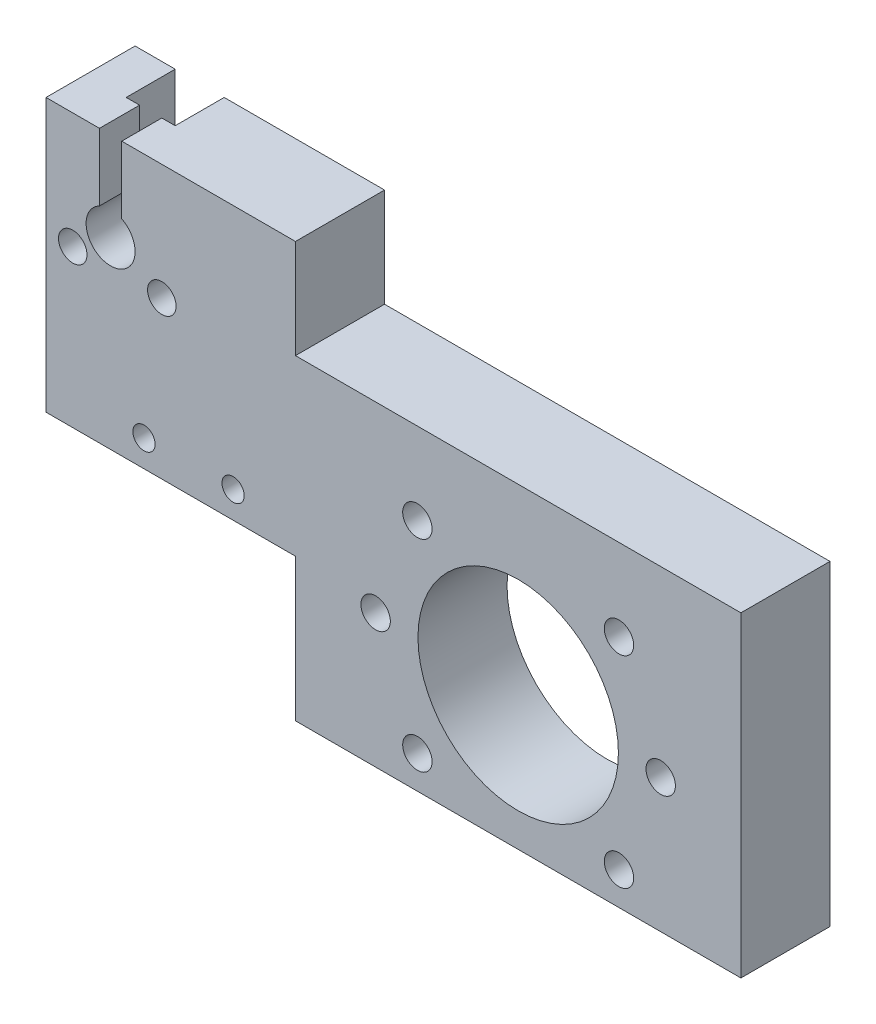
from build123d import *

# Parameters (mm, degrees)
SKETCH_1_W          = 50
SKETCH_1_H          = 35.5
EXTRUDE_1_DEPTH     = 10
SKETCH_2_R          = 11.25
CUT_EXTRUDE_1_DEPTH = 33.25
SKETCH_3_R          = 1.65
CUT_EXTRUDE_2_DEPTH = 33.25
SKETCH_4_W          = 25
SKETCH_4_H          = 19.5
EXTRUDE_2_DEPTH     = 10
SKETCH_5_R          = 1.25
CUT_EXTRUDE_3_DEPTH = 10
SKETCH_7_W          = 25
SKETCH_7_H          = 10
EXTRUDE_4_DEPTH     = 11.1
SKETCH_8_W          = 2.5
SKETCH_8_H          = 10
CUT_EXTRUDE_4_DEPTH = 59.586026491
SKETCH_9_W          = 5.5
SKETCH_9_H          = 10
CUT_EXTRUDE_5_DEPTH = 5.5
SKETCH_10_W         = 10
SKETCH_10_H         = 30.6
EXTRUDE_5_DEPTH     = 3
SKETCH_11_R         = 2.75
CUT_EXTRUDE_6_DEPTH = 62.166351044
SKETCH_13_R         = 1.6
CUT_EXTRUDE_8_DEPTH = 62.166351044


with BuildPart() as part:
    # 草图1 → 凸台-拉伸1 (new body)
    with BuildSketch(Plane.XY):
        Rectangle(SKETCH_1_W, SKETCH_1_H)
    extrude(amount=EXTRUDE_1_DEPTH)

    # 草图2 → 切除-拉伸1 (cut, through all)
    with BuildSketch(Plane.XY.offset(10)):
        with Locations((0, -2.75)):
            Circle(SKETCH_2_R)
    extrude(amount=-CUT_EXTRUDE_1_DEPTH, mode=Mode.SUBTRACT)

    # 草图3 → 切除-拉伸2 (cut, through all)
    with BuildSketch(Plane.XY.offset(10)):
        with Locations((-16, -2.75)):
            Circle(SKETCH_3_R)
        with Locations((-11.313708499, 8.563708499)):
            Circle(SKETCH_3_R)
        with Locations((11.313708499, 8.563708499)):
            Circle(SKETCH_3_R)
        with Locations((16, -2.75)):
            Circle(SKETCH_3_R)
        with Locations((11.313708499, -14.063708499)):
            Circle(SKETCH_3_R)
        with Locations((-11.313708499, -14.063708499)):
            Circle(SKETCH_3_R)
    extrude(amount=-CUT_EXTRUDE_2_DEPTH, mode=Mode.SUBTRACT)

    # 草图4 → 凸台-拉伸2 (add)
    with BuildSketch(Plane.XY.offset(10)):
        with Locations((-37.5, 8)):
            Rectangle(SKETCH_4_W, SKETCH_4_H)
    extrude(amount=-EXTRUDE_2_DEPTH)

    # 草图5 → 切除-拉伸3 (cut)
    with BuildSketch(Plane(origin=(0, 0, 0), x_dir=(-1, 0, 0), z_dir=(0, 0, -1))):
        with Locations((42, 1.25)):
            Circle(SKETCH_5_R)
        with Locations((32, 1.25)):
            Circle(SKETCH_5_R)
    extrude(amount=-CUT_EXTRUDE_3_DEPTH, mode=Mode.SUBTRACT)

    # 草图7 → 凸台-拉伸4 (add)
    with BuildSketch(Plane(origin=(0, 17.75, 0), x_dir=(1, 0, 0), z_dir=(0, 1, 0))):
        with Locations((-37.5, -5)):
            Rectangle(SKETCH_7_W, SKETCH_7_H)
    extrude(amount=EXTRUDE_4_DEPTH)

    # 草图8 → 切除-拉伸4 (cut, through all)
    with BuildSketch(Plane(origin=(0, 0, 0), x_dir=(-1, 0, 0), z_dir=(0, 0, -1))):
        with Locations((45.75, 23.85)):
            Rectangle(SKETCH_8_W, SKETCH_8_H)
    extrude(amount=-CUT_EXTRUDE_4_DEPTH, mode=Mode.SUBTRACT)

    # 草图9 → 切除-拉伸5 (cut)
    with BuildSketch(Plane(origin=(0, 0, 0), x_dir=(-1, 0, 0), z_dir=(0, 0, -1))):
        with Locations((45.75, 23.85)):
            Rectangle(SKETCH_9_W, SKETCH_9_H)
    extrude(amount=-CUT_EXTRUDE_5_DEPTH, mode=Mode.SUBTRACT)

    # 草图10 → 凸台-拉伸5 (add)
    with BuildSketch(Plane.ZY.offset(50)):
        with Locations((5, 13.55)):
            Rectangle(SKETCH_10_W, SKETCH_10_H)
    extrude(amount=EXTRUDE_5_DEPTH)

    # 草图11 → 切除-拉伸6 (cut, through all)
    with BuildSketch(Plane(origin=(0, 0, 0), x_dir=(-1, 0, 0), z_dir=(0, 0, -1))):
        with Locations((45.75, 18.85)):
            Circle(SKETCH_11_R)
    extrude(amount=-CUT_EXTRUDE_6_DEPTH, mode=Mode.SUBTRACT)

    # 草图13 → 切除-拉伸8 (cut, through all)
    with BuildSketch(Plane.XY.offset(10)):
        with Locations((-50, 15.85)):
            Circle(SKETCH_13_R)
        with Locations((-40, 15.85)):
            Circle(SKETCH_13_R)
    extrude(amount=-CUT_EXTRUDE_8_DEPTH, mode=Mode.SUBTRACT)


solid = part.part
